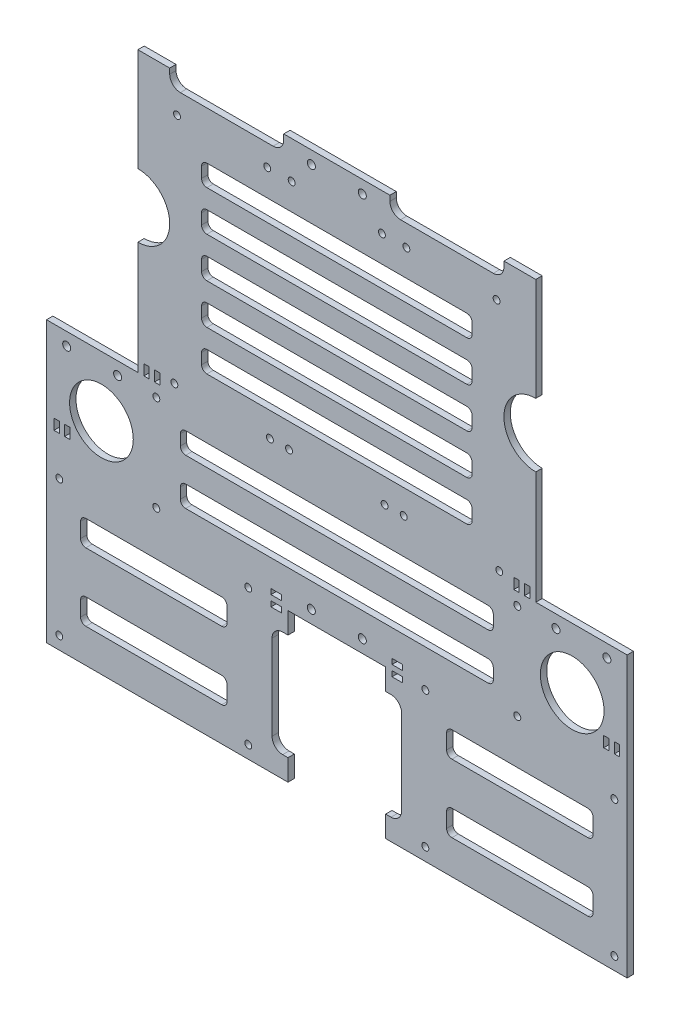
from build123d import *

# Parameters (mm, degrees)
SKETCH1_W             = 273.4
SKETCH1_H             = 263.4
BOSS_EXTRUDE1_DEPTH   = 3
SKETCH2_W             = 43
SKETCH2_H             = 131.64
CUT_EXTRUDE1_DEPTH    = 380.652630703
SKETCH3_W             = 46
SKETCH3_H             = 70
CUT_EXTRUDE2_DEPTH    = 380.652630703
F_4_CLEARANCE_HOLE1_D = 3.2639
CUT_EXTRUDE3_REACH    = 381.653
SKETCH4_R             = 15
SKETCH4_W             = 5
SKETCH4_H             = 2.5
SKETCH4_W_2           = 2.5
SKETCH4_H_2           = 5
F_6_CLEARANCE_HOLE1_D = 3.7973
CUT_EXTRUDE4_REACH    = 381.653


with BuildPart() as part:
    # Sketch1 → Boss-Extrude1 (new body)
    with BuildSketch(Plane.XY):
        with Locations((136.7, -131.7)):
            Rectangle(SKETCH1_W, SKETCH1_H)
    extrude(amount=BOSS_EXTRUDE1_DEPTH)

    # Sketch2 → Cut-Extrude1 (cut, through all)
    with BuildSketch(Plane.XY.offset(3)):
        with Locations((21.5, -65.82)):
            Rectangle(SKETCH2_W, SKETCH2_H)
        with Locations((251.9, -65.82)):
            Rectangle(SKETCH2_W, SKETCH2_H)
    extrude(amount=-CUT_EXTRUDE1_DEPTH, mode=Mode.SUBTRACT)

    # Sketch3 → Cut-Extrude2 (cut, through all)
    with BuildSketch(Plane(origin=(0, 0, 0), x_dir=(-1, 0, 0), z_dir=(0, 0, -1))):
        with Locations((-136.7, -228.4)):
            Rectangle(SKETCH3_W, SKETCH3_H)
    extrude(amount=-CUT_EXTRUDE2_DEPTH, mode=Mode.SUBTRACT)

    # #4 Clearance Hole1 (through all)
    with Locations(Plane(origin=(0, 0, 0), x_dir=(-1, 0, 0), z_dir=(0, 0, -1))):
        with Locations((-267.4, -257.4), (-267.4, -193.4), (-178.4, -193.4), (-178.4, -257.4), (-95, -257.4), (-95, -193.4), (-6, -193.4), (-6, -257.4), (-221.7, -137.5), (-221.7, -182.5), (-51.7, -137.5), (-51.7, -182.5), (-115.45, -17.5), (-157.95, -17.5), (-114.2, -127.5), (-159.2, -127.5), (-61.45, -17.5), (-103.95, -17.5), (-60.2, -127.5), (-105.2, -127.5), (-169.45, -17.5), (-211.95, -17.5), (-168.2, -127.5), (-213.2, -127.5)):
            Hole(F_4_CLEARANCE_HOLE1_D / 2)

    # Sketch4 → Cut-Extrude3 (cut, up to next)
    with BuildSketch(Plane.XY.offset(3), mode=Mode.PRIVATE) as cut_extrude3_sk1:
        with Locations((25.85, -160)):
            Circle(SKETCH4_R)
    cut_extrude3_tool1 = extrude(cut_extrude3_sk1.sketch, amount=-CUT_EXTRUDE3_REACH, mode=Mode.PRIVATE) & part.part
    # Sketch4 → Cut-Extrude3 (cut, up to next)
    with BuildSketch(Plane.XY.offset(3), mode=Mode.PRIVATE) as cut_extrude3_sk2:
        with Locations((247.55, -160)):
            Circle(SKETCH4_R)
    cut_extrude3_tool2 = extrude(cut_extrude3_sk2.sketch, amount=-CUT_EXTRUDE3_REACH, mode=Mode.PRIVATE) & part.part
    # Sketch4 → Cut-Extrude3 (cut, up to next)
    with BuildSketch(Plane.XY.offset(3), mode=Mode.PRIVATE) as cut_extrude3_sk3:
        with BuildLine():
            Line((58, 0), (111.7, 0))
            Line((111.7, 0), (111.7, -2.5))
            ThreePointArc((111.7, -2.5), (110.235533906, -6.035533906), (106.7, -7.5))
            Line((106.7, -7.5), (63, -7.5))
            ThreePointArc((63, -7.5), (59.464466094, -6.035533906), (58, -2.5))
            Line((58, -2.5), (58, 0))
        make_face()
    cut_extrude3_tool3 = extrude(cut_extrude3_sk3.sketch, amount=-CUT_EXTRUDE3_REACH, mode=Mode.PRIVATE) & part.part
    # Sketch4 → Cut-Extrude3 (cut, up to next)
    with BuildSketch(Plane.XY.offset(3), mode=Mode.PRIVATE) as cut_extrude3_sk4:
        with BuildLine():
            Line((43, -48.5), (43, -78.5))
            ThreePointArc((43, -78.5), (58, -63.5), (43, -48.5))
        make_face()
    cut_extrude3_tool4 = extrude(cut_extrude3_sk4.sketch, amount=-CUT_EXTRUDE3_REACH, mode=Mode.PRIVATE) & part.part
    # Sketch4 → Cut-Extrude3 (cut, up to next)
    with BuildSketch(Plane.XY.offset(3), mode=Mode.PRIVATE) as cut_extrude3_sk5:
        with BuildLine():
            Line((230.4, -48.5), (230.4, -78.5))
            ThreePointArc((230.4, -78.5), (215.4, -63.5), (230.4, -48.5))
        make_face()
    cut_extrude3_tool5 = extrude(cut_extrude3_sk5.sketch, amount=-CUT_EXTRUDE3_REACH, mode=Mode.PRIVATE) & part.part
    # Sketch4 → Cut-Extrude3 (cut, up to next)
    with BuildSketch(Plane.XY.offset(3), mode=Mode.PRIVATE) as cut_extrude3_sk6:
        with BuildLine():
            Line((210.4, -7.5), (166.7, -7.5))
            ThreePointArc((166.7, -7.5), (163.164466094, -6.035533906), (161.7, -2.5))
            Line((161.7, -2.5), (161.7, 0))
            Line((161.7, 0), (215.4, 0))
            Line((215.4, 0), (215.4, -2.5))
            ThreePointArc((215.4, -2.5), (213.935533906, -6.035533906), (210.4, -7.5))
        make_face()
    cut_extrude3_tool6 = extrude(cut_extrude3_sk6.sketch, amount=-CUT_EXTRUDE3_REACH, mode=Mode.PRIVATE) & part.part
    # Sketch4 → Cut-Extrude3 (cut, up to next)
    with BuildSketch(Plane.XY.offset(3), mode=Mode.PRIVATE) as cut_extrude3_sk7:
        with BuildLine():
            Line((159.7, -203.4), (162.2, -203.4))
            ThreePointArc((162.2, -203.4), (165.735533906, -204.864466094), (167.2, -208.4))
            Line((167.2, -208.4), (167.2, -248.4))
            ThreePointArc((167.2, -248.4), (165.735533906, -251.935533906), (162.2, -253.4))
            Line((162.2, -253.4), (159.7, -253.4))
            Line((159.7, -253.4), (159.7, -203.4))
        make_face()
    cut_extrude3_tool7 = extrude(cut_extrude3_sk7.sketch, amount=-CUT_EXTRUDE3_REACH, mode=Mode.PRIVATE) & part.part
    # Sketch4 → Cut-Extrude3 (cut, up to next)
    with BuildSketch(Plane.XY.offset(3), mode=Mode.PRIVATE) as cut_extrude3_sk8:
        with BuildLine():
            Line((106.2, -208.4), (106.2, -248.4))
            ThreePointArc((106.2, -248.4), (107.664466094, -251.935533906), (111.2, -253.4))
            Line((111.2, -253.4), (113.7, -253.4))
            Line((113.7, -253.4), (113.7, -203.4))
            Line((113.7, -203.4), (111.2, -203.4))
            ThreePointArc((111.2, -203.4), (107.664466094, -204.864466094), (106.2, -208.4))
        make_face()
    cut_extrude3_tool8 = extrude(cut_extrude3_sk8.sketch, amount=-CUT_EXTRUDE3_REACH, mode=Mode.PRIVATE) & part.part
    # Sketch4 → Cut-Extrude3 (cut, up to next)
    with BuildSketch(Plane.XY.offset(3), mode=Mode.PRIVATE) as cut_extrude3_sk9:
        with Locations((108.2, -194.65)):
            Rectangle(SKETCH4_W, SKETCH4_H)
    cut_extrude3_tool9 = extrude(cut_extrude3_sk9.sketch, amount=-CUT_EXTRUDE3_REACH, mode=Mode.PRIVATE) & part.part
    # Sketch4 → Cut-Extrude3 (cut, up to next)
    with BuildSketch(Plane.XY.offset(3), mode=Mode.PRIVATE) as cut_extrude3_sk10:
        with Locations((108.2, -189.65)):
            Rectangle(SKETCH4_W, SKETCH4_H)
    cut_extrude3_tool10 = extrude(cut_extrude3_sk10.sketch, amount=-CUT_EXTRUDE3_REACH, mode=Mode.PRIVATE) & part.part
    # Sketch4 → Cut-Extrude3 (cut, up to next)
    with BuildSketch(Plane.XY.offset(3), mode=Mode.PRIVATE) as cut_extrude3_sk11:
        with Locations((165.2, -189.65)):
            Rectangle(SKETCH4_W, SKETCH4_H)
    cut_extrude3_tool11 = extrude(cut_extrude3_sk11.sketch, amount=-CUT_EXTRUDE3_REACH, mode=Mode.PRIVATE) & part.part
    # Sketch4 → Cut-Extrude3 (cut, up to next)
    with BuildSketch(Plane.XY.offset(3), mode=Mode.PRIVATE) as cut_extrude3_sk12:
        with Locations((165.2, -194.65)):
            Rectangle(SKETCH4_W, SKETCH4_H)
    cut_extrude3_tool12 = extrude(cut_extrude3_sk12.sketch, amount=-CUT_EXTRUDE3_REACH, mode=Mode.PRIVATE) & part.part
    # Sketch4 → Cut-Extrude3 (cut, up to next)
    with BuildSketch(Plane.XY.offset(3), mode=Mode.PRIVATE) as cut_extrude3_sk13:
        with Locations((263.65, -172.5)):
            Rectangle(SKETCH4_W_2, SKETCH4_H_2)
    cut_extrude3_tool13 = extrude(cut_extrude3_sk13.sketch, amount=-CUT_EXTRUDE3_REACH, mode=Mode.PRIVATE) & part.part
    # Sketch4 → Cut-Extrude3 (cut, up to next)
    with BuildSketch(Plane.XY.offset(3), mode=Mode.PRIVATE) as cut_extrude3_sk14:
        with Locations((4.75, -172.5)):
            Rectangle(SKETCH4_W_2, SKETCH4_H_2)
    cut_extrude3_tool14 = extrude(cut_extrude3_sk14.sketch, amount=-CUT_EXTRUDE3_REACH, mode=Mode.PRIVATE) & part.part
    # Sketch4 → Cut-Extrude3 (cut, up to next)
    with BuildSketch(Plane.XY.offset(3), mode=Mode.PRIVATE) as cut_extrude3_sk15:
        with Locations((9.75, -172.5)):
            Rectangle(SKETCH4_W_2, SKETCH4_H_2)
    cut_extrude3_tool15 = extrude(cut_extrude3_sk15.sketch, amount=-CUT_EXTRUDE3_REACH, mode=Mode.PRIVATE) & part.part
    # Sketch4 → Cut-Extrude3 (cut, up to next)
    with BuildSketch(Plane.XY.offset(3), mode=Mode.PRIVATE) as cut_extrude3_sk16:
        with Locations((268.65, -172.5)):
            Rectangle(SKETCH4_W_2, SKETCH4_H_2)
    cut_extrude3_tool16 = extrude(cut_extrude3_sk16.sketch, amount=-CUT_EXTRUDE3_REACH, mode=Mode.PRIVATE) & part.part
    # Sketch4 → Cut-Extrude3 (cut, up to next)
    with BuildSketch(Plane.XY.offset(3), mode=Mode.PRIVATE) as cut_extrude3_sk17:
        with Locations((47.078150641, -129.14)):
            Rectangle(SKETCH4_W_2, SKETCH4_H_2)
    cut_extrude3_tool17 = extrude(cut_extrude3_sk17.sketch, amount=-CUT_EXTRUDE3_REACH, mode=Mode.PRIVATE) & part.part
    # Sketch4 → Cut-Extrude3 (cut, up to next)
    with BuildSketch(Plane.XY.offset(3), mode=Mode.PRIVATE) as cut_extrude3_sk18:
        with Locations((52.078150641, -129.14)):
            Rectangle(SKETCH4_W_2, SKETCH4_H_2)
    cut_extrude3_tool18 = extrude(cut_extrude3_sk18.sketch, amount=-CUT_EXTRUDE3_REACH, mode=Mode.PRIVATE) & part.part
    # Sketch4 → Cut-Extrude3 (cut, up to next)
    with BuildSketch(Plane.XY.offset(3), mode=Mode.PRIVATE) as cut_extrude3_sk19:
        with Locations((221.321849359, -129.14)):
            Rectangle(SKETCH4_W_2, SKETCH4_H_2)
    cut_extrude3_tool19 = extrude(cut_extrude3_sk19.sketch, amount=-CUT_EXTRUDE3_REACH, mode=Mode.PRIVATE) & part.part
    # Sketch4 → Cut-Extrude3 (cut, up to next)
    with BuildSketch(Plane.XY.offset(3), mode=Mode.PRIVATE) as cut_extrude3_sk20:
        with Locations((226.321849359, -129.14)):
            Rectangle(SKETCH4_W_2, SKETCH4_H_2)
    cut_extrude3_tool20 = extrude(cut_extrude3_sk20.sketch, amount=-CUT_EXTRUDE3_REACH, mode=Mode.PRIVATE) & part.part
    add(cut_extrude3_tool1.solids().sort_by_distance((25.85, -160, 3))[0], mode=Mode.SUBTRACT)
    add(cut_extrude3_tool2.solids().sort_by_distance((247.55, -160, 3))[0], mode=Mode.SUBTRACT)
    add(cut_extrude3_tool3.solids().sort_by_distance((84.85, -3.677927, 3))[0], mode=Mode.SUBTRACT)
    add(cut_extrude3_tool4.solids().sort_by_distance((49.366198, -63.5, 3))[0], mode=Mode.SUBTRACT)
    add(cut_extrude3_tool5.solids().sort_by_distance((224.033802, -63.5, 3))[0], mode=Mode.SUBTRACT)
    add(cut_extrude3_tool6.solids().sort_by_distance((188.55, -3.677927, 3))[0], mode=Mode.SUBTRACT)
    add(cut_extrude3_tool7.solids().sort_by_distance((163.372436, -228.4, 3))[0], mode=Mode.SUBTRACT)
    add(cut_extrude3_tool8.solids().sort_by_distance((110.027564, -228.4, 3))[0], mode=Mode.SUBTRACT)
    add(cut_extrude3_tool9.solids().sort_by_distance((108.2, -194.65, 3))[0], mode=Mode.SUBTRACT)
    add(cut_extrude3_tool10.solids().sort_by_distance((108.2, -189.65, 3))[0], mode=Mode.SUBTRACT)
    add(cut_extrude3_tool11.solids().sort_by_distance((165.2, -189.65, 3))[0], mode=Mode.SUBTRACT)
    add(cut_extrude3_tool12.solids().sort_by_distance((165.2, -194.65, 3))[0], mode=Mode.SUBTRACT)
    add(cut_extrude3_tool13.solids().sort_by_distance((263.65, -172.5, 3))[0], mode=Mode.SUBTRACT)
    add(cut_extrude3_tool14.solids().sort_by_distance((4.75, -172.5, 3))[0], mode=Mode.SUBTRACT)
    add(cut_extrude3_tool15.solids().sort_by_distance((9.75, -172.5, 3))[0], mode=Mode.SUBTRACT)
    add(cut_extrude3_tool16.solids().sort_by_distance((268.65, -172.5, 3))[0], mode=Mode.SUBTRACT)
    add(cut_extrude3_tool17.solids().sort_by_distance((47.078151, -129.14, 3))[0], mode=Mode.SUBTRACT)
    add(cut_extrude3_tool18.solids().sort_by_distance((52.078151, -129.14, 3))[0], mode=Mode.SUBTRACT)
    add(cut_extrude3_tool19.solids().sort_by_distance((221.321849, -129.14, 3))[0], mode=Mode.SUBTRACT)
    add(cut_extrude3_tool20.solids().sort_by_distance((226.321849, -129.14, 3))[0], mode=Mode.SUBTRACT)

    # #6 Clearance Hole1 (through all)
    with Locations(Plane.XY.offset(3)):
        with Locations((124.7, -6), (148.7, -6), (9.5, -137.64), (33.5, -137.64), (124.7, -187.4), (148.7, -187.4), (263.9, -137.64), (239.9, -137.64)):
            Hole(F_6_CLEARANCE_HOLE1_D / 2)

    # Sketch10 → Cut-Extrude4 (cut, up to next)
    with BuildSketch(Plane.XY.offset(3), mode=Mode.PRIVATE) as cut_extrude4_sk1:
        with BuildLine():
            Line((75.5, -30), (197.9, -30))
            ThreePointArc((197.9, -30), (199.667766953, -30.732233047), (200.4, -32.5))
            Line((200.4, -32.5), (200.4, -37.5))
            ThreePointArc((200.4, -37.5), (199.667766953, -39.267766953), (197.9, -40))
            Line((197.9, -40), (75.5, -40))
            ThreePointArc((75.5, -40), (73.732233047, -39.267766953), (73, -37.5))
            Line((73, -37.5), (73, -32.5))
            ThreePointArc((73, -32.5), (73.732233047, -30.732233047), (75.5, -30))
        make_face()
    cut_extrude4_tool1 = extrude(cut_extrude4_sk1.sketch, amount=-CUT_EXTRUDE4_REACH, mode=Mode.PRIVATE) & part.part
    # Sketch10 → Cut-Extrude4 (cut, up to next)
    with BuildSketch(Plane.XY.offset(3), mode=Mode.PRIVATE) as cut_extrude4_sk2:
        with BuildLine():
            Line((73, -51.5), (73, -56.5))
            ThreePointArc((73, -56.5), (73.732233047, -58.267766953), (75.5, -59))
            Line((75.5, -59), (197.9, -59))
            ThreePointArc((197.9, -59), (199.667766953, -58.267766953), (200.4, -56.5))
            Line((200.4, -56.5), (200.4, -51.5))
            ThreePointArc((200.4, -51.5), (199.667766953, -49.732233047), (197.9, -49))
            Line((197.9, -49), (75.5, -49))
            ThreePointArc((75.5, -49), (73.732233047, -49.732233047), (73, -51.5))
        make_face()
    cut_extrude4_tool2 = extrude(cut_extrude4_sk2.sketch, amount=-CUT_EXTRUDE4_REACH, mode=Mode.PRIVATE) & part.part
    # Sketch10 → Cut-Extrude4 (cut, up to next)
    with BuildSketch(Plane.XY.offset(3), mode=Mode.PRIVATE) as cut_extrude4_sk3:
        with BuildLine():
            Line((73, -70.5), (73, -75.5))
            ThreePointArc((73, -75.5), (73.732233047, -77.267766953), (75.5, -78))
            Line((75.5, -78), (197.9, -78))
            ThreePointArc((197.9, -78), (199.667766953, -77.267766953), (200.4, -75.5))
            Line((200.4, -75.5), (200.4, -70.5))
            ThreePointArc((200.4, -70.5), (199.667766953, -68.732233047), (197.9, -68))
            Line((197.9, -68), (75.5, -68))
            ThreePointArc((75.5, -68), (73.732233047, -68.732233047), (73, -70.5))
        make_face()
    cut_extrude4_tool3 = extrude(cut_extrude4_sk3.sketch, amount=-CUT_EXTRUDE4_REACH, mode=Mode.PRIVATE) & part.part
    # Sketch10 → Cut-Extrude4 (cut, up to next)
    with BuildSketch(Plane.XY.offset(3), mode=Mode.PRIVATE) as cut_extrude4_sk4:
        with BuildLine():
            Line((73, -89.5), (73, -94.5))
            ThreePointArc((73, -94.5), (73.732233047, -96.267766953), (75.5, -97))
            Line((75.5, -97), (197.9, -97))
            ThreePointArc((197.9, -97), (199.667766953, -96.267766953), (200.4, -94.5))
            Line((200.4, -94.5), (200.4, -89.5))
            ThreePointArc((200.4, -89.5), (199.667766953, -87.732233047), (197.9, -87))
            Line((197.9, -87), (75.5, -87))
            ThreePointArc((75.5, -87), (73.732233047, -87.732233047), (73, -89.5))
        make_face()
    cut_extrude4_tool4 = extrude(cut_extrude4_sk4.sketch, amount=-CUT_EXTRUDE4_REACH, mode=Mode.PRIVATE) & part.part
    # Sketch10 → Cut-Extrude4 (cut, up to next)
    with BuildSketch(Plane.XY.offset(3), mode=Mode.PRIVATE) as cut_extrude4_sk5:
        with BuildLine():
            Line((73, -108.5), (73, -113.5))
            ThreePointArc((73, -113.5), (73.732233047, -115.267766953), (75.5, -116))
            Line((75.5, -116), (197.9, -116))
            ThreePointArc((197.9, -116), (199.667766953, -115.267766953), (200.4, -113.5))
            Line((200.4, -113.5), (200.4, -108.5))
            ThreePointArc((200.4, -108.5), (199.667766953, -106.732233047), (197.9, -106))
            Line((197.9, -106), (75.5, -106))
            ThreePointArc((75.5, -106), (73.732233047, -106.732233047), (73, -108.5))
        make_face()
    cut_extrude4_tool5 = extrude(cut_extrude4_sk5.sketch, amount=-CUT_EXTRUDE4_REACH, mode=Mode.PRIVATE) & part.part
    # Sketch10 → Cut-Extrude4 (cut, up to next)
    with BuildSketch(Plane.XY.offset(3), mode=Mode.PRIVATE) as cut_extrude4_sk6:
        with BuildLine():
            Line((18.5, -203.4), (82.5, -203.4))
            ThreePointArc((82.5, -203.4), (84.267766953, -204.132233047), (85, -205.9))
            Line((85, -205.9), (85, -212.9))
            ThreePointArc((85, -212.9), (84.267766953, -214.667766953), (82.5, -215.4))
            Line((82.5, -215.4), (18.5, -215.4))
            ThreePointArc((18.5, -215.4), (16.732233047, -214.667766953), (16, -212.9))
            Line((16, -212.9), (16, -205.9))
            ThreePointArc((16, -205.9), (16.732233047, -204.132233047), (18.5, -203.4))
        make_face()
    cut_extrude4_tool6 = extrude(cut_extrude4_sk6.sketch, amount=-CUT_EXTRUDE4_REACH, mode=Mode.PRIVATE) & part.part
    # Sketch10 → Cut-Extrude4 (cut, up to next)
    with BuildSketch(Plane.XY.offset(3), mode=Mode.PRIVATE) as cut_extrude4_sk7:
        with BuildLine():
            Line((65.5, -144.14), (207.9, -144.14))
            ThreePointArc((207.9, -144.14), (209.667766953, -144.872233047), (210.4, -146.64))
            Line((210.4, -146.64), (210.4, -151.64))
            ThreePointArc((210.4, -151.64), (209.667766953, -153.407766953), (207.9, -154.14))
            Line((207.9, -154.14), (65.5, -154.14))
            ThreePointArc((65.5, -154.14), (63.732233047, -153.407766953), (63, -151.64))
            Line((63, -151.64), (63, -146.64))
            ThreePointArc((63, -146.64), (63.732233047, -144.872233047), (65.5, -144.14))
        make_face()
    cut_extrude4_tool7 = extrude(cut_extrude4_sk7.sketch, amount=-CUT_EXTRUDE4_REACH, mode=Mode.PRIVATE) & part.part
    # Sketch10 → Cut-Extrude4 (cut, up to next)
    with BuildSketch(Plane.XY.offset(3), mode=Mode.PRIVATE) as cut_extrude4_sk8:
        with BuildLine():
            Line((65.5, -165.86), (207.9, -165.86))
            ThreePointArc((207.9, -165.86), (209.667766953, -166.592233047), (210.4, -168.36))
            Line((210.4, -168.36), (210.4, -173.36))
            ThreePointArc((210.4, -173.36), (209.667766953, -175.127766953), (207.9, -175.86))
            Line((207.9, -175.86), (65.5, -175.86))
            ThreePointArc((65.5, -175.86), (63.732233047, -175.127766953), (63, -173.36))
            Line((63, -173.36), (63, -168.36))
            ThreePointArc((63, -168.36), (63.732233047, -166.592233047), (65.5, -165.86))
        make_face()
    cut_extrude4_tool8 = extrude(cut_extrude4_sk8.sketch, amount=-CUT_EXTRUDE4_REACH, mode=Mode.PRIVATE) & part.part
    # Sketch10 → Cut-Extrude4 (cut, up to next)
    with BuildSketch(Plane.XY.offset(3), mode=Mode.PRIVATE) as cut_extrude4_sk9:
        with BuildLine():
            Line((18.5, -235.4), (82.5, -235.4))
            ThreePointArc((82.5, -235.4), (84.267766953, -236.132233047), (85, -237.9))
            Line((85, -237.9), (85, -244.9))
            ThreePointArc((85, -244.9), (84.267766953, -246.667766953), (82.5, -247.4))
            Line((82.5, -247.4), (18.5, -247.4))
            ThreePointArc((18.5, -247.4), (16.732233047, -246.667766953), (16, -244.9))
            Line((16, -244.9), (16, -237.9))
            ThreePointArc((16, -237.9), (16.732233047, -236.132233047), (18.5, -235.4))
        make_face()
    cut_extrude4_tool9 = extrude(cut_extrude4_sk9.sketch, amount=-CUT_EXTRUDE4_REACH, mode=Mode.PRIVATE) & part.part
    # Sketch10 → Cut-Extrude4 (cut, up to next)
    with BuildSketch(Plane.XY.offset(3), mode=Mode.PRIVATE) as cut_extrude4_sk10:
        with BuildLine():
            Line((254.9, -215.4), (190.9, -215.4))
            ThreePointArc((190.9, -215.4), (189.132233047, -214.667766953), (188.4, -212.9))
            Line((188.4, -212.9), (188.4, -205.9))
            ThreePointArc((188.4, -205.9), (189.132233047, -204.132233047), (190.9, -203.4))
            Line((190.9, -203.4), (254.9, -203.4))
            ThreePointArc((254.9, -203.4), (256.667766953, -204.132233047), (257.4, -205.9))
            Line((257.4, -205.9), (257.4, -212.9))
            ThreePointArc((257.4, -212.9), (256.667766953, -214.667766953), (254.9, -215.4))
        make_face()
    cut_extrude4_tool10 = extrude(cut_extrude4_sk10.sketch, amount=-CUT_EXTRUDE4_REACH, mode=Mode.PRIVATE) & part.part
    # Sketch10 → Cut-Extrude4 (cut, up to next)
    with BuildSketch(Plane.XY.offset(3), mode=Mode.PRIVATE) as cut_extrude4_sk11:
        with BuildLine():
            Line((257.4, -244.9), (257.4, -237.9))
            ThreePointArc((257.4, -237.9), (256.667766953, -236.132233047), (254.9, -235.4))
            Line((254.9, -235.4), (190.9, -235.4))
            ThreePointArc((190.9, -235.4), (189.132233047, -236.132233047), (188.4, -237.9))
            Line((188.4, -237.9), (188.4, -244.9))
            ThreePointArc((188.4, -244.9), (189.132233047, -246.667766953), (190.9, -247.4))
            Line((190.9, -247.4), (254.9, -247.4))
            ThreePointArc((254.9, -247.4), (256.667766953, -246.667766953), (257.4, -244.9))
        make_face()
    cut_extrude4_tool11 = extrude(cut_extrude4_sk11.sketch, amount=-CUT_EXTRUDE4_REACH, mode=Mode.PRIVATE) & part.part
    add(cut_extrude4_tool1.solids().sort_by_distance((136.7, -35, 3))[0], mode=Mode.SUBTRACT)
    add(cut_extrude4_tool2.solids().sort_by_distance((136.7, -54, 3))[0], mode=Mode.SUBTRACT)
    add(cut_extrude4_tool3.solids().sort_by_distance((136.7, -73, 3))[0], mode=Mode.SUBTRACT)
    add(cut_extrude4_tool4.solids().sort_by_distance((136.7, -92, 3))[0], mode=Mode.SUBTRACT)
    add(cut_extrude4_tool5.solids().sort_by_distance((136.7, -111, 3))[0], mode=Mode.SUBTRACT)
    add(cut_extrude4_tool6.solids().sort_by_distance((50.5, -209.4, 3))[0], mode=Mode.SUBTRACT)
    add(cut_extrude4_tool7.solids().sort_by_distance((136.7, -149.14, 3))[0], mode=Mode.SUBTRACT)
    add(cut_extrude4_tool8.solids().sort_by_distance((136.7, -170.86, 3))[0], mode=Mode.SUBTRACT)
    add(cut_extrude4_tool9.solids().sort_by_distance((50.5, -241.4, 3))[0], mode=Mode.SUBTRACT)
    add(cut_extrude4_tool10.solids().sort_by_distance((222.9, -209.4, 3))[0], mode=Mode.SUBTRACT)
    add(cut_extrude4_tool11.solids().sort_by_distance((222.9, -241.4, 3))[0], mode=Mode.SUBTRACT)


solid = part.part
